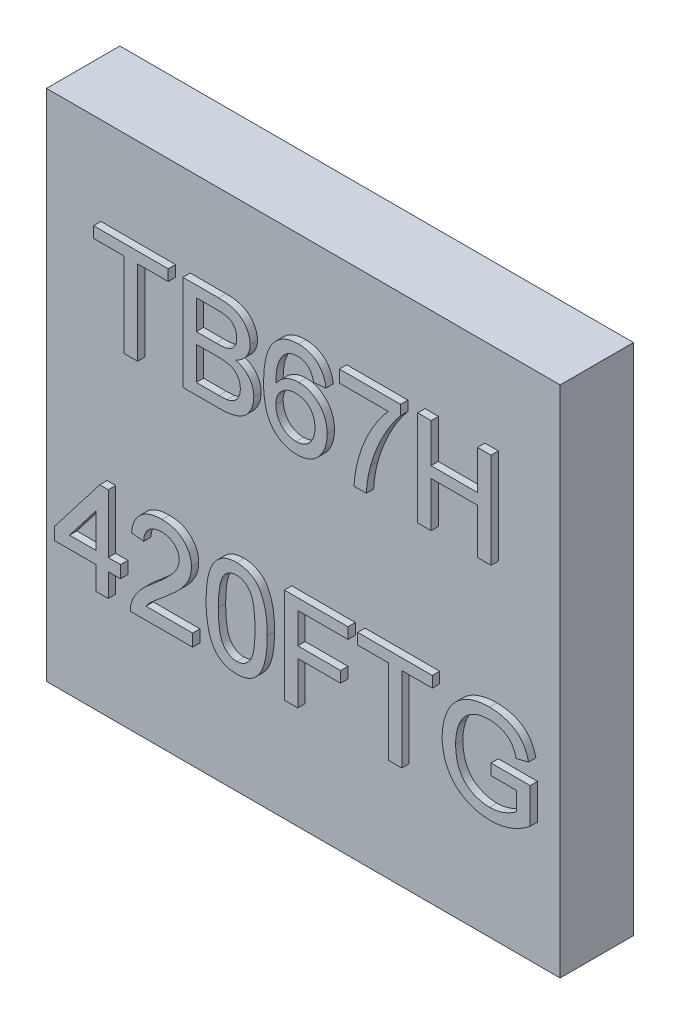
from build123d import *

# Parameters (mm, degrees)
SKETCH1_W           = 7
SKETCH1_H           = 7
BOSS_EXTRUDE1_DEPTH = 1
BOSS_EXTRUDE2_DEPTH = 0.1


with BuildPart() as part:
    # Sketch1 → Boss-Extrude1 (new body)
    with BuildSketch(Plane.XY):
        Rectangle(SKETCH1_W, SKETCH1_H)
    extrude(amount=BOSS_EXTRUDE1_DEPTH)

    # Sketch2 → Boss-Extrude2 (add)
    # profile 1 of 11: a face of its own
    with BuildSketch(Plane.XY.offset(1)):
        Polygon((-2.341666667, 1), (-2.341666667, 2.15), (-2.758333333, 2.15), (-2.758333333, 2.3), (-1.741666667, 2.3), (-1.741666667, 2.15), (-2.158333333, 2.15), (-2.158333333, 1), align=None)
    # profile 2 of 11: a face of its own
    with BuildSketch(Plane.XY.offset(1)):
        with BuildLine():
            Line((-1.541666667, 1), (-1.541666667, 2.3))
            Line((-1.541666667, 2.3), (-1.054947917, 2.3))
            add(Edge.make_bspline(
                [(-1.054947917, 2.3), (-1.042878097, 2.299953697), (-1.019326447, 2.299863347), (-0.984936167, 2.297603792), (-0.952366005, 2.294513189), (-0.921545843, 2.290529307), (-0.892609041, 2.284748776), (-0.865582564, 2.277746048), (-0.840325766, 2.269668627), (-0.809453181, 2.2573641), (-0.77387591, 2.238424817), (-0.735769273, 2.210164417), (-0.702615019, 2.176233815), (-0.675333943, 2.137330459), (-0.652857279, 2.095774337), (-0.636921587, 2.052357133), (-0.626733037, 2.008024146), (-0.625577026, 1.978004997), (-0.625, 1.963020833)],
                knots=[0, 0, 0, 0, 0.939712594, 1.833646414, 2.682508961, 3.487467313, 4.25240329, 4.978730417, 5.660668875, 6.315918528, 7.564895217, 8.787077865, 9.996481721, 11.241996224, 12.475862915, 13.665015424, 14.834484263, 16, 16, 16, 16], degree=3))
            add(Edge.make_bspline(
                [(-0.625, 1.963020833), (-0.625606577, 1.949080102), (-0.626813882, 1.92133304), (-0.636422682, 1.88045993), (-0.651588307, 1.840772395), (-0.673032931, 1.802752916), (-0.700441848, 1.76709705), (-0.734421079, 1.735011189), (-0.774482344, 1.706426569), (-0.804548322, 1.691190127), (-0.820052083, 1.683333333)],
                knots=[0, 0, 0, 0, 0.926741525, 1.844548388, 2.778836836, 3.746021974, 4.738420572, 5.759761325, 6.844803049, 8, 8, 8, 8], degree=3))
            add(Edge.make_bspline(
                [(-0.820052083, 1.683333333), (-0.810461354, 1.680331024), (-0.791684337, 1.674453012), (-0.764690424, 1.663697075), (-0.739351385, 1.651449902), (-0.715612062, 1.637691367), (-0.693632859, 1.622294059), (-0.673475794, 1.605233974), (-0.655001105, 1.586775113), (-0.638241801, 1.566928704), (-0.62352051, 1.545822464), (-0.610317352, 1.52391769), (-0.599414757, 1.500950602), (-0.590478298, 1.476980827), (-0.583506531, 1.452156478), (-0.578500044, 1.426382077), (-0.575646474, 1.399717617), (-0.575217877, 1.381603907), (-0.575, 1.372395833)],
                knots=[0, 0, 0, 0, 1.127427615, 2.20731145, 3.257257018, 4.283066884, 5.282973838, 6.264540225, 7.242620376, 8.210460609, 9.17525685, 10.12748095, 11.077310519, 12.023587065, 12.994999128, 13.967387486, 14.966724908, 16, 16, 16, 16], degree=3))
            add(Edge.make_bspline(
                [(-0.575, 1.372395833), (-0.575449077, 1.3576124), (-0.576339202, 1.328309836), (-0.583487899, 1.28518139), (-0.595568817, 1.243695459), (-0.612197174, 1.204522822), (-0.63201053, 1.168301951), (-0.654529103, 1.135981228), (-0.679178624, 1.107893231), (-0.706653197, 1.084266204), (-0.736775599, 1.064213773), (-0.770396615, 1.047328314), (-0.807256293, 1.032436958), (-0.848103785, 1.020541193), (-0.892920498, 1.011091213), (-0.942314636, 1.004951545), (-0.996362085, 1.000556366), (-1.034017601, 1.000190638), (-1.053645833, 1)],
                knots=[0, 0, 0, 0, 1.028073207, 2.037766189, 3.031549473, 4.027532207, 4.992436545, 5.898794514, 6.762903869, 7.584966804, 8.412380356, 9.273953678, 10.198004568, 11.174406109, 12.229717296, 13.381036288, 14.634844708, 16, 16, 16, 16], degree=3))
            Line((-1.053645833, 1), (-1.541666667, 1))
        make_face()
        with BuildLine():
            Line((-1.358333333, 1.75), (-1.090364583, 1.75))
            add(Edge.make_bspline(
                [(-1.090364583, 1.75), (-1.081595979, 1.750034692), (-1.064749508, 1.750101343), (-1.040448876, 1.751030657), (-1.018020558, 1.751823495), (-0.997551308, 1.753813456), (-0.978939722, 1.755762535), (-0.962260279, 1.758386299), (-0.947431285, 1.761342686), (-0.938351488, 1.764084957), (-0.934114583, 1.765364583)],
                knots=[0, 0, 0, 0, 1.335841395, 2.566453063, 3.705076039, 4.753984432, 5.69893722, 6.555639608, 7.326018133, 8, 8, 8, 8], degree=3))
            add(Edge.make_bspline(
                [(-0.934114583, 1.765364583), (-0.924159376, 1.768851893), (-0.904967819, 1.775574697), (-0.879249338, 1.790842861), (-0.857344667, 1.809164582), (-0.839312507, 1.830863379), (-0.825455685, 1.855823127), (-0.815181252, 1.883526222), (-0.809555771, 1.914359928), (-0.808751889, 1.93574202), (-0.808333333, 1.946875)],
                knots=[0, 0, 0, 0, 1.059015028, 2.041559358, 2.989777133, 3.920090524, 4.862499371, 5.848878527, 6.879979022, 8, 8, 8, 8], degree=3))
            add(Edge.make_bspline(
                [(-0.808333333, 1.946875), (-0.808669881, 1.957574514), (-0.809325773, 1.978426632), (-0.8148314, 2.008707523), (-0.824358684, 2.036878332), (-0.837261236, 2.062932879), (-0.853599295, 2.08611214), (-0.873099338, 2.10604088), (-0.896459014, 2.121106129), (-0.918293313, 2.130503863), (-0.937931535, 2.136383032), (-0.955477597, 2.139861494), (-0.975380064, 2.142926365), (-0.99770443, 2.145532017), (-1.02245914, 2.147554243), (-1.049720468, 2.149160767), (-1.079423519, 2.149842858), (-1.099999841, 2.149946315), (-1.110677083, 2.15)],
                knots=[0, 0, 0, 0, 1.216168307, 2.37017178, 3.484610845, 4.588286376, 5.664695412, 6.69777344, 7.738183022, 8.803673002, 9.390844981, 10.0665252, 10.835811589, 11.680682236, 12.621801058, 13.660007223, 14.785756265, 16, 16, 16, 16], degree=3))
            Line((-1.110677083, 2.15), (-1.358333333, 2.15))
            Line((-1.358333333, 2.15), (-1.358333333, 1.75))
        make_face(mode=Mode.SUBTRACT)
        with BuildLine():
            Line((-1.358333333, 1.15), (-1.05078125, 1.15))
            add(Edge.make_bspline(
                [(-1.05078125, 1.15), (-1.038541387, 1.150140619), (-1.016053381, 1.150398974), (-0.985294182, 1.151209447), (-0.960431239, 1.153189131), (-0.945912595, 1.155320744), (-0.939583333, 1.15625)],
                knots=[0, 0, 0, 0, 1.317581857, 2.420761387, 3.311546315, 4, 4, 4, 4], degree=3))
            add(Edge.make_bspline(
                [(-0.939583333, 1.15625), (-0.930509051, 1.158157322), (-0.912938895, 1.161850391), (-0.88816919, 1.170092935), (-0.865458502, 1.179535209), (-0.845203212, 1.19153529), (-0.8264473, 1.205364562), (-0.810147016, 1.222637983), (-0.795133681, 1.242263515), (-0.782125947, 1.264722704), (-0.771607306, 1.28956855), (-0.763568089, 1.316417169), (-0.759285816, 1.345174423), (-0.758655308, 1.364917839), (-0.758333333, 1.375)],
                knots=[0, 0, 0, 0, 1.067651492, 2.067249321, 3.003744366, 3.895862395, 4.774133402, 5.679610569, 6.621910665, 7.616993802, 8.661192143, 9.724711987, 10.838102842, 12, 12, 12, 12], degree=3))
            add(Edge.make_bspline(
                [(-0.758333333, 1.375), (-0.758692048, 1.386837061), (-0.759391579, 1.409920538), (-0.766040858, 1.443277332), (-0.777024378, 1.474216173), (-0.792485974, 1.502308589), (-0.811450428, 1.527575299), (-0.834395503, 1.549008361), (-0.86114963, 1.566016556), (-0.891795034, 1.579364698), (-0.927613374, 1.58886167), (-0.969593521, 1.595304791), (-1.018406961, 1.599462382), (-1.053288962, 1.599813119), (-1.071875, 1.6)],
                knots=[0, 0, 0, 0, 0.96167883, 1.875371887, 2.752872588, 3.621584364, 4.472914353, 5.312011319, 6.159851575, 7.038572308, 8.019870099, 9.164119506, 10.488969081, 12, 12, 12, 12], degree=3))
            Line((-1.071875, 1.6), (-1.358333333, 1.6))
            Line((-1.358333333, 1.6), (-1.358333333, 1.15))
        make_face(mode=Mode.SUBTRACT)
    # profile 3 of 11: a face of its own
    with BuildSketch(Plane.XY.offset(1)):
        with BuildLine():
            Line((0.408333333, 1.966666667), (0.241666667, 1.95))
            add(Edge.make_bspline(
                [(0.241666667, 1.95), (0.238070134, 1.964334223), (0.231300215, 1.99131619), (0.217103758, 2.027913159), (0.201459565, 2.05886797), (0.187868162, 2.075536281), (0.181510417, 2.083333333)],
                knots=[0, 0, 0, 0, 1.199207122, 2.257322842, 3.184815751, 4, 4, 4, 4], degree=3))
            add(Edge.make_bspline(
                [(0.181510417, 2.083333333), (0.176053032, 2.088651351), (0.165319618, 2.099110661), (0.147699261, 2.112744446), (0.129124487, 2.124295672), (0.109539157, 2.133653917), (0.08904908, 2.141046393), (0.06756938, 2.146217824), (0.04514872, 2.149419233), (0.02987184, 2.149804762), (0.022135417, 2.15)],
                knots=[0, 0, 0, 0, 1.028360939, 2.022547923, 3.001693811, 3.976902288, 4.948369586, 5.937776631, 6.955661634, 8, 8, 8, 8], degree=3))
            add(Edge.make_bspline(
                [(0.022135417, 2.15), (0.009593344, 2.149596161), (-0.015189244, 2.148798192), (-0.051549729, 2.14098614), (-0.086865981, 2.129294159), (-0.108745705, 2.117441925), (-0.119791667, 2.111458333)],
                knots=[0, 0, 0, 0, 1.010336883, 1.996381556, 2.988474728, 4, 4, 4, 4], degree=3))
            add(Edge.make_bspline(
                [(-0.119791667, 2.111458333), (-0.130654685, 2.102458042), (-0.152953863, 2.083982597), (-0.182054564, 2.049843845), (-0.208078938, 2.010096143), (-0.227272383, 1.972988636), (-0.24078012, 1.939718493), (-0.249516189, 1.911204968), (-0.256980074, 1.87970339), (-0.263197911, 1.845273112), (-0.268007007, 1.807886207), (-0.272026449, 1.767518929), (-0.274249542, 1.724068927), (-0.274744684, 1.694099405), (-0.275, 1.678645833)],
                knots=[0, 0, 0, 0, 1.063306303, 2.18271343, 3.369442992, 4.644240368, 5.329284104, 6.077448525, 6.892756613, 7.771869145, 8.717113863, 9.73749892, 10.833357348, 12, 12, 12, 12], degree=3))
            add(Edge.make_bspline(
                [(-0.275, 1.678645833), (-0.265173895, 1.692451217), (-0.245938694, 1.719476099), (-0.212006345, 1.75482665), (-0.174953788, 1.784709084), (-0.134739596, 1.808568205), (-0.092413082, 1.827059615), (-0.0489076, 1.840365849), (-0.004299395, 1.848533567), (0.025747232, 1.849508704), (0.040885417, 1.85)],
                knots=[0, 0, 0, 0, 1.083917396, 2.121834425, 3.126226247, 4.123362703, 5.106535049, 6.077135049, 7.031216202, 8, 8, 8, 8], degree=3))
            add(Edge.make_bspline(
                [(0.040885417, 1.85), (0.053923103, 1.849649218), (0.079681533, 1.848956182), (0.117613737, 1.843464189), (0.15397954, 1.833858317), (0.189094089, 1.821344462), (0.222282595, 1.804258081), (0.254355047, 1.784289134), (0.284568645, 1.759989216), (0.313305773, 1.732685488), (0.33946981, 1.702329815), (0.362626838, 1.669658467), (0.381924415, 1.634593134), (0.397572519, 1.597368651), (0.409819895, 1.558120473), (0.418719068, 1.516737145), (0.423928525, 1.473136874), (0.424638056, 1.443329984), (0.425, 1.428125)],
                knots=[0, 0, 0, 0, 0.981553735, 1.939246043, 2.877808487, 3.810434071, 4.740031046, 5.683044261, 6.650811044, 7.654063953, 8.664382933, 9.663624521, 10.66421212, 11.671863278, 12.699354266, 13.755775259, 14.855184124, 16, 16, 16, 16], degree=3))
            add(Edge.make_bspline(
                [(0.425, 1.428125), (0.424351525, 1.40803044), (0.423071777, 1.368374308), (0.412799787, 1.309975352), (0.396248004, 1.253684404), (0.376447881, 1.209106853), (0.358256737, 1.174955686), (0.342810328, 1.151068844), (0.326293759, 1.12862123), (0.309019885, 1.107303948), (0.289735818, 1.088092653), (0.269610668, 1.07008212), (0.247979223, 1.053895021), (0.225477687, 1.038992758), (0.201680991, 1.026070977), (0.177281554, 1.014588578), (0.152078524, 1.004807686), (0.125990523, 0.997128034), (0.09915116, 0.990774502), (0.071471101, 0.986405863), (0.043023197, 0.983711613), (0.023790808, 0.983460403), (0.0140625, 0.983333333)],
                knots=[0, 0, 0, 0, 1.777979151, 3.508799182, 5.232661887, 6.960203328, 7.816385973, 8.656273476, 9.47551652, 10.283326439, 11.082130802, 11.882412381, 12.672407567, 13.471692325, 14.269609044, 15.067192643, 15.857822979, 16.66013129, 17.472860815, 18.297850482, 19.139002666, 20, 20, 20, 20], degree=3))
            add(Edge.make_bspline(
                [(0.0140625, 0.983333333), (-0.002366793, 0.983788926), (-0.034587525, 0.984682425), (-0.081747281, 0.991546682), (-0.126527531, 1.00301782), (-0.169023531, 1.019055768), (-0.209364736, 1.039303348), (-0.247153594, 1.064685086), (-0.282599201, 1.094448373), (-0.315728882, 1.128765826), (-0.345767534, 1.168392162), (-0.37143992, 1.214133113), (-0.393315071, 1.265588289), (-0.411217979, 1.322899257), (-0.424765312, 1.386125953), (-0.434519963, 1.455132583), (-0.440518965, 1.529929032), (-0.441275156, 1.58175917), (-0.441666667, 1.60859375)],
                knots=[0, 0, 0, 0, 0.898506621, 1.76212948, 2.600594211, 3.422599815, 4.24233914, 5.064166416, 5.906856258, 6.769969817, 7.668413694, 8.619051846, 9.63165591, 10.722000005, 11.898403521, 13.164960021, 14.532183992, 16, 16, 16, 16], degree=3))
            add(Edge.make_bspline(
                [(-0.441666667, 1.60859375), (-0.441601749, 1.623874225), (-0.441473708, 1.654012545), (-0.439416212, 1.69836864), (-0.43705601, 1.741205171), (-0.433012176, 1.782351241), (-0.428237469, 1.82199191), (-0.421829876, 1.859894063), (-0.414948893, 1.896352303), (-0.406583022, 1.931079585), (-0.397257121, 1.964402603), (-0.386522684, 1.995955208), (-0.37518446, 2.026145636), (-0.362321481, 2.054497634), (-0.348612541, 2.081472958), (-0.333459315, 2.106572423), (-0.317567698, 2.130369935), (-0.305835846, 2.145044228), (-0.3, 2.15234375)],
                knots=[0, 0, 0, 0, 1.28053818, 2.525659045, 3.721026795, 4.875695215, 5.990149104, 7.066600796, 8.096771069, 9.099076143, 10.059445332, 10.995815448, 11.891625124, 12.761078582, 13.603822678, 14.426062074, 15.217066536, 16, 16, 16, 16], degree=3))
            add(Edge.make_bspline(
                [(-0.3, 2.15234375), (-0.289501418, 2.164152587), (-0.268807737, 2.187428902), (-0.233407356, 2.217496386), (-0.195685267, 2.243178644), (-0.15503985, 2.263927685), (-0.11178176, 2.280104303), (-0.065883877, 2.291847095), (-0.017218125, 2.298657103), (0.016037523, 2.299545112), (0.033072917, 2.3)],
                knots=[0, 0, 0, 0, 1.005002357, 1.980952959, 2.948226316, 3.90482984, 4.879026092, 5.883055346, 6.915583142, 8, 8, 8, 8], degree=3))
            add(Edge.make_bspline(
                [(0.033072917, 2.3), (0.045757658, 2.299775773), (0.070677855, 2.299335261), (0.107192304, 2.295108503), (0.141923962, 2.28804411), (0.174950184, 2.278515035), (0.206078933, 2.265830618), (0.235669085, 2.250798211), (0.263420176, 2.232715171), (0.289131303, 2.211828551), (0.312866152, 2.188730431), (0.334125125, 2.163226843), (0.352828121, 2.135635651), (0.3691214, 2.105899471), (0.382859366, 2.074159064), (0.394138918, 2.040278013), (0.402712131, 2.004265026), (0.406433627, 1.979373175), (0.408333333, 1.966666667)],
                knots=[0, 0, 0, 0, 1.095988384, 2.15315746, 3.171326302, 4.156539379, 5.119213808, 6.072133135, 7.021027441, 7.975952916, 8.930907862, 9.879001051, 10.840359051, 11.807350428, 12.805278655, 13.825435679, 14.889953203, 16, 16, 16, 16], degree=3))
        make_face()
        with BuildLine():
            add(Edge.make_bspline(
                [(-0.275, 1.431510417), (-0.274536423, 1.418460493), (-0.273615356, 1.392531965), (-0.26657024, 1.354045514), (-0.255065067, 1.316494964), (-0.239297098, 1.280297349), (-0.219826559, 1.246666093), (-0.196700097, 1.21686648), (-0.170419696, 1.191336041), (-0.141126591, 1.170019376), (-0.108889543, 1.153638107), (-0.074285923, 1.141773809), (-0.037274391, 1.134602989), (-0.011750967, 1.133762944), (0.001302083, 1.133333333)],
                knots=[0, 0, 0, 0, 1.034121613, 2.054667162, 3.090870403, 4.141799978, 5.178094622, 6.163726224, 7.122467907, 8.07367165, 9.024701118, 9.977919151, 10.965878387, 12, 12, 12, 12], degree=3))
            add(Edge.make_bspline(
                [(0.001302083, 1.133333333), (0.010603866, 1.1335849), (0.028760123, 1.134075935), (0.055343833, 1.137880966), (0.080707629, 1.143731973), (0.104704648, 1.152376795), (0.127302325, 1.163409966), (0.148617992, 1.176838059), (0.168637866, 1.192701277), (0.187119891, 1.210970501), (0.203823642, 1.231289162), (0.218336987, 1.253532575), (0.231153626, 1.277334777), (0.240793785, 1.303280697), (0.248649119, 1.330705628), (0.254424289, 1.359868881), (0.257814922, 1.390803939), (0.258158027, 1.412057404), (0.258333333, 1.422916667)],
                knots=[0, 0, 0, 0, 1.023436885, 1.997658284, 2.950132304, 3.883974581, 4.798406504, 5.712938251, 6.651509614, 7.604127386, 8.56812849, 9.540661787, 10.523651728, 11.536824179, 12.580180944, 13.661349568, 14.805088061, 16, 16, 16, 16], degree=3))
            add(Edge.make_bspline(
                [(0.258333333, 1.422916667), (0.258170739, 1.433344658), (0.257852766, 1.453737912), (0.254274905, 1.483496003), (0.24906282, 1.51162795), (0.241061664, 1.53789704), (0.231241616, 1.562581376), (0.218937203, 1.585496312), (0.204600236, 1.606836604), (0.187790731, 1.626037172), (0.169408336, 1.643530018), (0.149219602, 1.658724224), (0.127466819, 1.671556555), (0.104071514, 1.682061981), (0.078989619, 1.690113154), (0.052273071, 1.695692813), (0.024072195, 1.699587659), (0.004701456, 1.699860446), (-0.005208333, 1.7)],
                knots=[0, 0, 0, 0, 1.155658139, 2.260035327, 3.319019312, 4.323913291, 5.299809325, 6.260058621, 7.202437855, 8.144128683, 9.083751266, 10.011616631, 10.939332216, 11.87851101, 12.849505762, 13.853846437, 14.90205895, 16, 16, 16, 16], degree=3))
            add(Edge.make_bspline(
                [(-0.005208333, 1.7), (-0.014424451, 1.699856005), (-0.032585688, 1.699572249), (-0.059219296, 1.695647012), (-0.084888686, 1.690056171), (-0.10949137, 1.681922284), (-0.133035812, 1.671447386), (-0.15551679, 1.658705918), (-0.176739079, 1.643332872), (-0.196896192, 1.626116829), (-0.215289314, 1.606992181), (-0.231426586, 1.586301585), (-0.24458882, 1.563911929), (-0.256094749, 1.540370956), (-0.264524743, 1.515123735), (-0.270522789, 1.488508755), (-0.274241425, 1.460521101), (-0.274743208, 1.441331098), (-0.275, 1.431510417)],
                knots=[0, 0, 0, 0, 1.036988316, 2.04348404, 3.025371103, 3.992992706, 4.955812186, 5.923433788, 6.897355974, 7.902569022, 8.905116476, 9.880852345, 10.849905012, 11.825004025, 12.826645469, 13.839294292, 14.894236693, 16, 16, 16, 16], degree=3))
        make_face(mode=Mode.SUBTRACT)
    # profile 4 of 11: a face of its own
    with BuildSketch(Plane.XY.offset(1)):
        with BuildLine():
            Line((0.591666667, 2.116666667), (0.591666667, 2.283333333))
            Line((0.591666667, 2.283333333), (1.425, 2.283333333))
            Line((1.425, 2.283333333), (1.425, 2.1484375))
            add(Edge.make_bspline(
                [(1.425, 2.1484375), (1.415189492, 2.136964931), (1.395130449, 2.113507558), (1.366070829, 2.076143728), (1.336860209, 2.036364), (1.308012027, 1.99378585), (1.279095234, 1.948720013), (1.250226209, 1.901022559), (1.221287098, 1.850809664), (1.183327649, 1.780501823), (1.138040067, 1.690490062), (1.090981971, 1.579579373), (1.049205257, 1.467563228), (1.026973586, 1.391381483), (1.015885417, 1.353385417)],
                knots=[0, 0, 0, 0, 0.603281671, 1.233499104, 1.891379699, 2.575603978, 3.288773649, 4.031381703, 4.80386477, 5.604951941, 7.224880277, 8.828980706, 10.418436603, 12, 12, 12, 12], degree=3))
            add(Edge.make_bspline(
                [(1.015885417, 1.353385417), (1.008694269, 1.325944627), (0.994064804, 1.270119872), (0.978050045, 1.183431096), (0.965668262, 1.093044989), (0.960806164, 1.031368336), (0.958333333, 1)],
                knots=[0, 0, 0, 0, 0.948866074, 1.930345965, 2.947387709, 4, 4, 4, 4], degree=3))
            Line((0.958333333, 1), (0.791666667, 1))
            add(Edge.make_bspline(
                [(0.791666667, 1), (0.792066427, 1.012940842), (0.792888509, 1.03955292), (0.796523826, 1.080445211), (0.801365735, 1.123369534), (0.80820452, 1.168180879), (0.816897179, 1.21497021), (0.827255619, 1.263787086), (0.839626626, 1.314530543), (0.857922641, 1.384883018), (0.885095198, 1.47334545), (0.924656472, 1.577944162), (0.970153008, 1.680747959), (1.013575924, 1.764116392), (1.050605048, 1.829037074), (1.07870502, 1.876142036), (1.107604063, 1.921027848), (1.136766413, 1.964017406), (1.166197124, 2.005146915), (1.196495715, 2.044031924), (1.226768879, 2.081453629), (1.247904638, 2.105032502), (1.258333333, 2.116666667)],
                knots=[0, 0, 0, 0, 0.630312875, 1.296201307, 1.998242258, 2.7335219, 3.502880474, 4.315318118, 5.163159648, 6.045885937, 7.85484959, 9.666009448, 11.488277305, 13.325849397, 14.240191093, 15.127469759, 15.996293014, 16.839220888, 17.656853801, 18.458354243, 19.239329216, 20, 20, 20, 20], degree=3))
            Line((1.258333333, 2.116666667), (0.591666667, 2.116666667))
        make_face()
    # profile 5 of 11: a face of its own
    with BuildSketch(Plane.XY.offset(1)):
        Polygon((1.658333333, 1), (1.658333333, 2.3), (1.841666667, 2.3), (1.841666667, 1.766666667), (2.475, 1.766666667), (2.475, 2.3), (2.658333333, 2.3), (2.658333333, 1), (2.475, 1), (2.475, 1.616666667), (1.841666667, 1.616666667), (1.841666667, 1), align=None)
    # profile 6 of 11: a face of its own
    with BuildSketch(Plane.XY.offset(1)):
        Polygon((-2.725, -2), (-2.725, -1.683333333), (-3.291666667, -1.683333333), (-3.291666667, -1.516666667), (-2.675, -0.716666667), (-2.558333333, -0.716666667), (-2.558333333, -1.516666667), (-2.391666667, -1.516666667), (-2.391666667, -1.683333333), (-2.558333333, -1.683333333), (-2.558333333, -2), align=None)
        Polygon((-2.725, -1.516666667), (-2.725, -1.0484375), (-3.0859375, -1.516666667), align=None, mode=Mode.SUBTRACT)
    # profile 7 of 11: a face of its own
    with BuildSketch(Plane.XY.offset(1)):
        with BuildLine():
            Line((-1.408333333, -1.833333333), (-1.408333333, -2))
            Line((-1.408333333, -2), (-2.258333333, -2))
            add(Edge.make_bspline(
                [(-2.258333333, -2), (-2.258350735, -1.990094531), (-2.25838548, -1.970316795), (-2.255038769, -1.941066778), (-2.249797148, -1.912204787), (-2.24387045, -1.89369674), (-2.240885417, -1.884375)],
                knots=[0, 0, 0, 0, 1.01057331, 2.01775941, 3.001627217, 4, 4, 4, 4], degree=3))
            add(Edge.make_bspline(
                [(-2.240885417, -1.884375), (-2.235370068, -1.86914439), (-2.22413991, -1.838132359), (-2.201387493, -1.793386329), (-2.174625273, -1.748910914), (-2.148568485, -1.712701647), (-2.124706093, -1.683772974), (-2.104694368, -1.661139635), (-2.082517708, -1.637971746), (-2.058193873, -1.614273538), (-2.031956965, -1.589891528), (-2.003771185, -1.564744403), (-1.973303702, -1.539300806), (-1.952034211, -1.522435731), (-1.941145833, -1.513802083)],
                knots=[0, 0, 0, 0, 1.204657718, 2.452881516, 3.728232997, 5.065887527, 5.768225529, 6.518857853, 7.313994055, 8.154655305, 9.046094665, 9.979688118, 10.965752482, 12, 12, 12, 12], degree=3))
            add(Edge.make_bspline(
                [(-1.941145833, -1.513802083), (-1.924418596, -1.499723039), (-1.892209239, -1.472612946), (-1.846724579, -1.432384081), (-1.805181746, -1.3950293), (-1.768242263, -1.359893887), (-1.735604002, -1.32731863), (-1.707190329, -1.297377334), (-1.682756764, -1.270163439), (-1.662601593, -1.244691918), (-1.645596057, -1.220639717), (-1.631185367, -1.197178281), (-1.619175969, -1.173897788), (-1.609173747, -1.150871906), (-1.601262839, -1.128002165), (-1.59587043, -1.105221936), (-1.592213485, -1.082757253), (-1.591847605, -1.067809003), (-1.591666667, -1.060416667)],
                knots=[0, 0, 0, 0, 1.782554561, 3.432421876, 4.950675607, 6.337395053, 7.588547463, 8.709982106, 9.702713005, 10.569305638, 11.356701089, 12.103210377, 12.812277205, 13.490692607, 14.148717897, 14.782152033, 15.397739362, 16, 16, 16, 16], degree=3))
            add(Edge.make_bspline(
                [(-1.591666667, -1.060416667), (-1.591847627, -1.053110582), (-1.59220266, -1.038776441), (-1.595571203, -1.017798516), (-1.600260485, -0.997596272), (-1.607841626, -0.978533395), (-1.616865467, -0.960045359), (-1.62844072, -0.942716363), (-1.641830909, -0.926114522), (-1.657161541, -0.91067755), (-1.673906182, -0.896195206), (-1.692615932, -0.88415686), (-1.71206194, -0.873318761), (-1.732915077, -0.864604308), (-1.755141457, -0.85820513), (-1.778579284, -0.853560975), (-1.803224836, -0.850616331), (-1.820043694, -0.850208559), (-1.828645833, -0.85)],
                knots=[0, 0, 0, 0, 0.988194508, 1.938783882, 2.870742509, 3.789494954, 4.709148727, 5.651055405, 6.603531303, 7.592354411, 8.592907906, 9.593461401, 10.59787167, 11.603930315, 12.645063138, 13.723588815, 14.835711238, 16, 16, 16, 16], degree=3))
            add(Edge.make_bspline(
                [(-1.828645833, -0.85), (-1.837682142, -0.850207526), (-1.855366861, -0.850613669), (-1.881217186, -0.853570056), (-1.905757587, -0.858087016), (-1.928929493, -0.864993061), (-1.950704699, -0.873692982), (-1.97099452, -0.884643866), (-1.99012388, -0.897005433), (-2.007490323, -0.911640595), (-2.023194569, -0.927868006), (-2.037136284, -0.945534747), (-2.048559424, -0.96498175), (-2.057993125, -0.985781419), (-2.065578609, -1.007999141), (-2.071085413, -1.031804765), (-2.07408776, -1.057129556), (-2.074691506, -1.074471966), (-2.075, -1.083333333)],
                knots=[0, 0, 0, 0, 1.131143733, 2.213731411, 3.253917892, 4.251203413, 5.236093891, 6.184197493, 7.13373276, 8.082770301, 9.020476205, 9.957489029, 10.893177274, 11.836722509, 12.812818608, 13.827831385, 14.890097571, 16, 16, 16, 16], degree=3))
            Line((-2.075, -1.083333333), (-2.241666667, -1.066666667))
            add(Edge.make_bspline(
                [(-2.241666667, -1.066666667), (-2.23996143, -1.052141259), (-2.236644039, -1.02388333), (-2.228380869, -0.982956479), (-2.216780127, -0.944882775), (-2.202898861, -0.909131393), (-2.185497385, -0.876310927), (-2.165826514, -0.845742524), (-2.14262563, -0.818395684), (-2.116994808, -0.793408397), (-2.088653236, -0.771388022), (-2.057867137, -0.752150167), (-2.024650595, -0.736058889), (-1.989188615, -0.722735982), (-1.951399783, -0.712627557), (-1.911337559, -0.705378863), (-1.868937516, -0.700910685), (-1.83985481, -0.700307893), (-1.825, -0.7)],
                knots=[0, 0, 0, 0, 1.130804643, 2.199883102, 3.223565206, 4.205909148, 5.160801384, 6.091796021, 7.01151579, 7.927798993, 8.855738875, 9.7815393, 10.730299821, 11.705391175, 12.706931101, 13.751121791, 14.851322166, 16, 16, 16, 16], degree=3))
            add(Edge.make_bspline(
                [(-1.825, -0.7), (-1.809967386, -0.700257416), (-1.780683765, -0.700758865), (-1.738012822, -0.705889693), (-1.697751608, -0.713880911), (-1.659752527, -0.725018222), (-1.624240081, -0.739622559), (-1.591186955, -0.75746576), (-1.560440747, -0.77837377), (-1.532515163, -0.802597578), (-1.507333934, -0.829041921), (-1.4852663, -0.857263736), (-1.466816695, -0.887142459), (-1.451108002, -0.918270821), (-1.439456285, -0.951306546), (-1.431262583, -0.985800505), (-1.425694724, -1.021782176), (-1.425234653, -1.046332552), (-1.425, -1.058854167)],
                knots=[0, 0, 0, 0, 1.195390245, 2.328627238, 3.413424916, 4.457841177, 5.473507151, 6.462241215, 7.441013641, 8.425227782, 9.397253344, 10.342087291, 11.269524934, 12.186751184, 13.110685745, 14.048630397, 15.004728144, 16, 16, 16, 16], degree=3))
            add(Edge.make_bspline(
                [(-1.425, -1.058854167), (-1.425358312, -1.071718707), (-1.426075727, -1.097476178), (-1.431675245, -1.135976), (-1.441256082, -1.174058013), (-1.453957715, -1.212185699), (-1.47131079, -1.250510384), (-1.493233453, -1.289560758), (-1.520430912, -1.32948107), (-1.546587242, -1.363417771), (-1.57093454, -1.391865284), (-1.592516119, -1.41527925), (-1.617484757, -1.440155022), (-1.644903787, -1.467354107), (-1.675891488, -1.495911153), (-1.709557512, -1.526681315), (-1.746638824, -1.558854842), (-1.772380482, -1.580834251), (-1.785677083, -1.5921875)],
                knots=[0, 0, 0, 0, 0.927118007, 1.856282007, 2.79721255, 3.754929441, 4.749232485, 5.824981375, 6.979078785, 8.228161913, 8.911614355, 9.677694854, 10.522803217, 11.452009355, 12.461436787, 13.560019032, 14.739651695, 16, 16, 16, 16], degree=3))
            add(Edge.make_bspline(
                [(-1.785677083, -1.5921875), (-1.797063614, -1.60145735), (-1.818775976, -1.619133527), (-1.849666016, -1.644759154), (-1.877334097, -1.668257159), (-1.902427232, -1.688861083), (-1.924031545, -1.707567511), (-1.942908019, -1.723557184), (-1.958370859, -1.737634056), (-1.981918029, -1.759017108), (-2.011742528, -1.789496487), (-2.033718494, -1.819112449), (-2.044270833, -1.833333333)],
                knots=[0, 0, 0, 0, 1.241996727, 2.368296581, 3.394949853, 4.3125351, 5.114548721, 5.812230366, 6.404953749, 6.883082049, 8.503329734, 10, 10, 10, 10], degree=3))
            Line((-2.044270833, -1.833333333), (-1.408333333, -1.833333333))
        make_face()
    # profile 8 of 11: a face of its own
    with BuildSketch(Plane.XY.offset(1)):
        with BuildLine():
            add(Edge.make_bspline(
                [(-1.225, -1.358854167), (-1.224832083, -1.340275973), (-1.224503205, -1.303889116), (-1.222463281, -1.250648608), (-1.218901739, -1.200088301), (-1.213585337, -1.152252106), (-1.207289721, -1.107032046), (-1.199105381, -1.064492656), (-1.189896808, -1.024538491), (-1.178848173, -0.987211197), (-1.16670934, -0.952189828), (-1.152937447, -0.919530565), (-1.137442199, -0.889268035), (-1.120985092, -0.861088399), (-1.102699789, -0.835429966), (-1.083689954, -0.811572655), (-1.062574067, -0.790391406), (-1.040230171, -0.771341226), (-1.016329247, -0.754530552), (-0.990997754, -0.740024968), (-0.964333161, -0.727217583), (-0.93582727, -0.717576187), (-0.906071858, -0.709716405), (-0.874837883, -0.703934654), (-0.842090927, -0.700526117), (-0.819712985, -0.700177354), (-0.808333333, -0.7)],
                knots=[0, 0, 0, 0, 1.514747001, 2.966751498, 4.343369068, 5.64627492, 6.890416844, 8.064737671, 9.177176366, 10.232018008, 11.237056675, 12.19799043, 13.119080079, 14.007588942, 14.855863561, 15.685992447, 16.491747269, 17.290132607, 18.077525251, 18.870243746, 19.668095604, 20.485086593, 21.319398728, 22.175900658, 23.072407314, 24, 24, 24, 24], degree=3))
            add(Edge.make_bspline(
                [(-0.808333333, -0.7), (-0.791637904, -0.700490834), (-0.758839064, -0.701455096), (-0.710952589, -0.709319448), (-0.665822672, -0.722772633), (-0.623478634, -0.74092156), (-0.58464434, -0.763974191), (-0.549963679, -0.791998176), (-0.519810738, -0.824699269), (-0.494514588, -0.862464966), (-0.472403229, -0.904253439), (-0.452759983, -0.950252248), (-0.435003058, -1.000409848), (-0.422402358, -1.045307901), (-0.41341429, -1.084065494), (-0.407464902, -1.116031661), (-0.402525718, -1.150523334), (-0.398741635, -1.18745707), (-0.395636884, -1.226791444), (-0.393239228, -1.268550946), (-0.392022172, -1.312839947), (-0.39178739, -1.343228554), (-0.391666667, -1.358854167)],
                knots=[0, 0, 0, 0, 1.134486744, 2.228744715, 3.287356444, 4.328707449, 5.352829806, 6.347195599, 7.349461267, 8.364207941, 9.428085653, 10.559314403, 11.761222316, 13.04268526, 13.726896727, 14.465273606, 15.252205015, 16.094778733, 16.988606776, 17.934225168, 18.937792761, 20, 20, 20, 20], degree=3))
            add(Edge.make_bspline(
                [(-0.391666667, -1.358854167), (-0.391837729, -1.377345095), (-0.392171932, -1.413470765), (-0.394157195, -1.466284374), (-0.397933345, -1.516463228), (-0.402579967, -1.564122271), (-0.409609332, -1.609134276), (-0.417183854, -1.651690487), (-0.426551667, -1.691597662), (-0.437481704, -1.728873291), (-0.449791409, -1.763714474), (-0.463290905, -1.796384521), (-0.478242893, -1.826861108), (-0.4950924, -1.854846983), (-0.513068486, -1.88071361), (-0.532302806, -1.904558021), (-0.55320315, -1.926037026), (-0.5757484, -1.945030066), (-0.599481509, -1.962138854), (-0.624874588, -1.976787652), (-0.651816494, -1.988923926), (-0.680127218, -1.999299838), (-0.710094013, -2.006902698), (-0.741480564, -2.012722568), (-0.774402515, -2.016149729), (-0.796867013, -2.016491977), (-0.808333333, -2.016666667)],
                knots=[0, 0, 0, 0, 1.508974709, 2.94807912, 4.311757619, 5.615040294, 6.854280449, 8.028314546, 9.141715822, 10.197470207, 11.196696834, 12.155719058, 13.080757287, 13.963948316, 14.818758719, 15.649605906, 16.461113142, 17.260189315, 18.052359509, 18.845763934, 19.647754795, 20.461145776, 21.303032214, 22.167241874, 23.064524267, 24, 24, 24, 24], degree=3))
            add(Edge.make_bspline(
                [(-0.808333333, -2.016666667), (-0.823367009, -2.01623783), (-0.852678539, -2.015401717), (-0.895485868, -2.009720845), (-0.935662829, -1.999722243), (-0.973548292, -1.986312707), (-1.008716415, -1.968376681), (-1.041335111, -1.946554003), (-1.072059829, -1.921352401), (-1.089746844, -1.901468915), (-1.098697917, -1.89140625)],
                knots=[0, 0, 0, 0, 1.10322584, 2.150986741, 3.161425019, 4.136713905, 5.093944212, 6.049774532, 7.013026876, 8, 8, 8, 8], degree=3))
            add(Edge.make_bspline(
                [(-1.098697917, -1.89140625), (-1.109000807, -1.87654418), (-1.130245807, -1.845897955), (-1.155111238, -1.7936433), (-1.177291642, -1.73611826), (-1.194699193, -1.672194203), (-1.208333645, -1.602379891), (-1.218181123, -1.526538334), (-1.223753826, -1.444702297), (-1.224575232, -1.388116201), (-1.225, -1.358854167)],
                knots=[0, 0, 0, 0, 0.779365345, 1.607084704, 2.489375761, 3.438383567, 4.461919411, 5.557722155, 6.737039282, 8, 8, 8, 8], degree=3))
        make_face()
        with BuildLine():
            add(Edge.make_bspline(
                [(-1.058333333, -1.358333333), (-1.058167847, -1.383337062), (-1.057851068, -1.431199728), (-1.054541505, -1.499579806), (-1.048844227, -1.561267969), (-1.041312054, -1.616178808), (-1.031366536, -1.664386599), (-1.018878762, -1.705768495), (-1.00480207, -1.740821172), (-0.98738243, -1.76911018), (-0.968309849, -1.792169847), (-0.948618713, -1.812001907), (-0.927845756, -1.828858704), (-0.906126521, -1.842913835), (-0.883124018, -1.853555457), (-0.859089774, -1.861268528), (-0.834018562, -1.865707282), (-0.816943927, -1.866345047), (-0.808333333, -1.866666667)],
                knots=[0, 0, 0, 0, 1.89448813, 3.626469325, 5.185477471, 6.587276848, 7.82441448, 8.910550357, 9.859733512, 10.6775885, 11.416198291, 12.123144072, 12.791880183, 13.439617036, 14.078171869, 14.70637855, 15.347637704, 16, 16, 16, 16], degree=3))
            add(Edge.make_bspline(
                [(-0.808333333, -1.866666667), (-0.799724896, -1.86633802), (-0.782654537, -1.865686319), (-0.757525395, -1.861345444), (-0.733584663, -1.853235309), (-0.710616456, -1.842631273), (-0.688739359, -1.828896501), (-0.668068425, -1.811976033), (-0.64827356, -1.792155748), (-0.629286652, -1.768828054), (-0.611999726, -1.740408257), (-0.597658973, -1.705384134), (-0.585365814, -1.663929766), (-0.575365722, -1.615746536), (-0.567802478, -1.560922516), (-0.562139647, -1.499405447), (-0.558807935, -1.431113353), (-0.558496384, -1.383337175), (-0.558333333, -1.358333333)],
                knots=[0, 0, 0, 0, 0.652509534, 1.29391342, 1.924290653, 2.562989607, 3.207355802, 3.876242846, 4.583348185, 5.32723334, 6.150888545, 7.094226006, 8.186903555, 9.424320409, 10.81992305, 12.379283064, 14.105084285, 16, 16, 16, 16], degree=3))
            add(Edge.make_bspline(
                [(-0.558333333, -1.358333333), (-0.558491164, -1.333849741), (-0.558793561, -1.286940105), (-0.562211202, -1.219877372), (-0.567566954, -1.159224619), (-0.574892771, -1.10492593), (-0.58462878, -1.057040254), (-0.596437231, -1.015465649), (-0.610508767, -0.98029078), (-0.627239772, -0.951162313), (-0.645864729, -0.927269068), (-0.665320261, -0.906587386), (-0.686092761, -0.888998289), (-0.708550253, -0.874888056), (-0.73196889, -0.863504445), (-0.756886774, -0.855669953), (-0.78305898, -0.850856687), (-0.801020626, -0.850288825), (-0.81015625, -0.85)],
                knots=[0, 0, 0, 0, 1.850066095, 3.544656626, 5.0727657, 6.45041401, 7.682899467, 8.762389858, 9.712573485, 10.538438529, 11.291566246, 11.996865408, 12.681389046, 13.341983376, 13.996294293, 14.643563182, 15.31009126, 16, 16, 16, 16], degree=3))
            add(Edge.make_bspline(
                [(-0.81015625, -0.85), (-0.818766302, -0.85022598), (-0.835744223, -0.850671583), (-0.860602121, -0.854924863), (-0.88415966, -0.862037295), (-0.906686731, -0.871671775), (-0.92762096, -0.884637881), (-0.947792544, -0.899776733), (-0.966256726, -0.918221735), (-0.97738308, -0.93201093), (-0.983072917, -0.9390625)],
                knots=[0, 0, 0, 0, 1.021318143, 2.013908504, 2.982026795, 3.937174072, 4.91255697, 5.897578595, 6.924855925, 8, 8, 8, 8], degree=3))
            add(Edge.make_bspline(
                [(-0.983072917, -0.9390625), (-0.989267413, -0.949419072), (-1.002348884, -0.971289971), (-1.016986289, -1.009302496), (-1.029916394, -1.052743576), (-1.040562158, -1.102281584), (-1.048263621, -1.157831542), (-1.054343629, -1.21932894), (-1.057501966, -1.286859636), (-1.058048565, -1.33385144), (-1.058333333, -1.358333333)],
                knots=[0, 0, 0, 0, 0.671104906, 1.417232262, 2.260109084, 3.195198885, 4.23592645, 5.382417421, 6.636286093, 8, 8, 8, 8], degree=3))
        make_face(mode=Mode.SUBTRACT)
    # profile 9 of 11: a face of its own
    with BuildSketch(Plane.XY.offset(1)):
        Polygon((-0.158333333, -2), (-0.158333333, -0.7), (0.708333333, -0.7), (0.708333333, -0.85), (0.025, -0.85), (0.025, -1.266666667), (0.608333333, -1.266666667), (0.608333333, -1.416666667), (0.025, -1.416666667), (0.025, -2), align=None)
    # profile 10 of 11: a face of its own
    with BuildSketch(Plane.XY.offset(1)):
        Polygon((1.258333333, -2), (1.258333333, -0.85), (0.841666667, -0.85), (0.841666667, -0.7), (1.858333333, -0.7), (1.858333333, -0.85), (1.441666667, -0.85), (1.441666667, -2), align=None)
    # profile 11 of 11: a face of its own
    with BuildSketch(Plane.XY.offset(1)):
        with BuildLine():
            Line((2.658333333, -1.483333333), (2.658333333, -1.333333333))
            Line((2.658333333, -1.333333333), (3.191666667, -1.333333333))
            Line((3.191666667, -1.333333333), (3.191666667, -1.814322917))
            add(Edge.make_bspline(
                [(3.191666667, -1.814322917), (3.170623965, -1.83034963), (3.129209316, -1.861892189), (3.064258885, -1.903028158), (2.998243155, -1.937916349), (2.931344572, -1.966718904), (2.863333196, -1.988948732), (2.794502654, -2.004860319), (2.72477799, -2.014938541), (2.677898085, -2.016090116), (2.654427083, -2.016666667)],
                knots=[0, 0, 0, 0, 1.08433114, 2.134098231, 3.14842993, 4.143565882, 5.117308249, 6.078377492, 7.037916032, 8, 8, 8, 8], degree=3))
            add(Edge.make_bspline(
                [(2.654427083, -2.016666667), (2.638706379, -2.01642534), (2.607476653, -2.015945937), (2.561239457, -2.011844616), (2.516081901, -2.005750638), (2.472089638, -1.996789771), (2.429107359, -1.985381604), (2.387217852, -1.97128315), (2.34640356, -1.954831329), (2.306891991, -1.935970043), (2.26927703, -1.914359845), (2.233662179, -1.890665965), (2.200496729, -1.864531459), (2.169729632, -1.836170094), (2.141472133, -1.805413137), (2.115305561, -1.772669372), (2.091931789, -1.737338788), (2.070834686, -1.700071262), (2.052205869, -1.66114881), (2.035940367, -1.620903586), (2.02249539, -1.579432138), (2.011282099, -1.536917932), (2.002364688, -1.493376991), (1.996136153, -1.448672854), (1.992469735, -1.402839711), (1.991936109, -1.371881571), (1.991666667, -1.35625)],
                knots=[0, 0, 0, 0, 1.072770755, 2.131096365, 3.165876834, 4.181397123, 5.193125461, 6.199217581, 7.195986042, 8.195005739, 9.184865672, 10.154356418, 11.112044544, 12.063776475, 13.007136321, 13.960176652, 14.921449994, 15.895149614, 16.88092309, 17.86448639, 18.855604391, 19.854360534, 20.864074582, 21.88711945, 22.933151623, 24, 24, 24, 24], degree=3))
            add(Edge.make_bspline(
                [(1.991666667, -1.35625), (1.99193685, -1.340705237), (1.992473423, -1.309833936), (1.996171159, -1.263831079), (2.002422516, -1.218633684), (2.011052764, -1.174215906), (2.021944116, -1.130616274), (2.035512375, -1.087826348), (2.051745649, -1.045885325), (2.070130922, -1.004881837), (2.090607627, -0.965402568), (2.114123151, -0.928709211), (2.138846739, -0.893944419), (2.16681816, -0.862619547), (2.196090643, -0.833117243), (2.228096472, -0.80685961), (2.262028921, -0.783056229), (2.298034748, -0.761962935), (2.335902154, -0.743554681), (2.375179261, -0.727342427), (2.415955211, -0.713889279), (2.457996289, -0.702539109), (2.501535449, -0.694105756), (2.546460466, -0.687761821), (2.592822101, -0.684138353), (2.624212732, -0.683603899), (2.640104167, -0.683333333)],
                knots=[0, 0, 0, 0, 1.059979929, 2.105079288, 3.144800512, 4.169876923, 5.189194625, 6.207600986, 7.228841866, 8.254191695, 9.270945245, 10.257936415, 11.22408152, 12.176290364, 13.118065146, 14.055588944, 14.994904974, 15.942096138, 16.897776019, 17.864011786, 18.837383209, 19.823806203, 20.831455606, 21.859450402, 22.916351634, 24, 24, 24, 24], degree=3))
            add(Edge.make_bspline(
                [(2.640104167, -0.683333333), (2.663044968, -0.683885247), (2.707868267, -0.684963615), (2.773492509, -0.693350608), (2.835557447, -0.707701923), (2.884743395, -0.724190044), (2.921685969, -0.740257953), (2.947798981, -0.753244062), (2.972344717, -0.767424714), (2.99560572, -0.78233908), (3.017062576, -0.798965843), (3.03699723, -0.816523178), (3.05546214, -0.835221594), (3.078195155, -0.861907828), (3.104200754, -0.898977643), (3.130294006, -0.94931631), (3.153148501, -1.005430294), (3.164460012, -1.045614996), (3.1703125, -1.06640625)],
                knots=[0, 0, 0, 0, 1.539867261, 3.008697525, 4.432261777, 5.810773619, 6.484177873, 7.135742803, 7.767512201, 8.386601754, 8.989234153, 9.587908519, 10.168964172, 10.7517707, 11.940093668, 13.199243526, 14.550910222, 16, 16, 16, 16], degree=3))
            Line((3.1703125, -1.06640625), (3.002604167, -1.10859375))
            add(Edge.make_bspline(
                [(3.002604167, -1.10859375), (2.997763683, -1.093165909), (2.988493078, -1.063618156), (2.972163927, -1.022320743), (2.953141842, -0.986660759), (2.932802547, -0.955271999), (2.908571373, -0.928270144), (2.880438026, -0.904344628), (2.847560123, -0.883566107), (2.810661655, -0.865775605), (2.770546539, -0.851248154), (2.727850678, -0.840895623), (2.683008784, -0.834457182), (2.652365918, -0.833713222), (2.63671875, -0.833333333)],
                knots=[0, 0, 0, 0, 1.164883671, 2.23101188, 3.193404931, 4.072828119, 4.918883984, 5.797350418, 6.725503451, 7.712871826, 8.743577122, 9.793233972, 10.87315899, 12, 12, 12, 12], degree=3))
            add(Edge.make_bspline(
                [(2.63671875, -0.833333333), (2.618210264, -0.833799902), (2.582375564, -0.834703236), (2.530446051, -0.84117895), (2.482390564, -0.852226021), (2.438370171, -0.867967166), (2.398569756, -0.887316352), (2.362419865, -0.909196002), (2.330533329, -0.934244344), (2.302788945, -0.962141875), (2.278660615, -0.991985469), (2.257144735, -1.023093028), (2.238433885, -1.055715527), (2.228440115, -1.078632528), (2.2234375, -1.090104167)],
                knots=[0, 0, 0, 0, 1.282088634, 2.482280855, 3.618640035, 4.691464057, 5.71354971, 6.679981643, 7.61357903, 8.515091979, 9.399860987, 10.268958177, 11.133486685, 12, 12, 12, 12], degree=3))
            add(Edge.make_bspline(
                [(2.2234375, -1.090104167), (2.215967151, -1.110280745), (2.200930637, -1.150892689), (2.186241445, -1.214898296), (2.176759374, -1.28131112), (2.17559234, -1.32652859), (2.175, -1.349479167)],
                knots=[0, 0, 0, 0, 0.971932623, 1.956331326, 2.96271565, 4, 4, 4, 4], degree=3))
            add(Edge.make_bspline(
                [(2.175, -1.349479167), (2.175089768, -1.363548457), (2.175265625, -1.391110647), (2.178417587, -1.431579718), (2.182538877, -1.470401197), (2.189227513, -1.507384703), (2.197179689, -1.542640464), (2.207043185, -1.576187763), (2.219099828, -1.607859155), (2.232566358, -1.637964782), (2.247974385, -1.666179438), (2.265132896, -1.692473075), (2.283978205, -1.716831668), (2.304446048, -1.739282087), (2.326232805, -1.760275307), (2.350020796, -1.779010205), (2.375542525, -1.795758887), (2.411348475, -1.815704531), (2.458559725, -1.835839871), (2.517081341, -1.853804615), (2.577564151, -1.864474334), (2.618448415, -1.865931802), (2.6390625, -1.866666667)],
                knots=[0, 0, 0, 0, 1.070760406, 2.097653971, 3.088708526, 4.041547766, 4.95691435, 5.839291284, 6.700934147, 7.534993757, 8.348268852, 9.145600082, 9.922850605, 10.690119832, 11.456705726, 12.223547942, 12.991528328, 13.778467112, 15.341275849, 16.888285822, 18.431055468, 20, 20, 20, 20], degree=3))
            add(Edge.make_bspline(
                [(2.6390625, -1.866666667), (2.657145557, -1.866071546), (2.693228326, -1.864884048), (2.746948051, -1.856643732), (2.799823239, -1.842651393), (2.850945199, -1.823760173), (2.898766447, -1.802121853), (2.941096447, -1.778936422), (2.977854341, -1.75580116), (2.998530609, -1.738086236), (3.008333333, -1.7296875)],
                knots=[0, 0, 0, 0, 1.08078364, 2.156585965, 3.240205791, 4.344938036, 5.41078367, 6.374425311, 7.229306744, 8, 8, 8, 8], degree=3))
            Line((3.008333333, -1.7296875), (3.008333333, -1.483333333))
            Line((3.008333333, -1.483333333), (2.658333333, -1.483333333))
        make_face()
    extrude(amount=BOSS_EXTRUDE2_DEPTH)


solid = part.part
